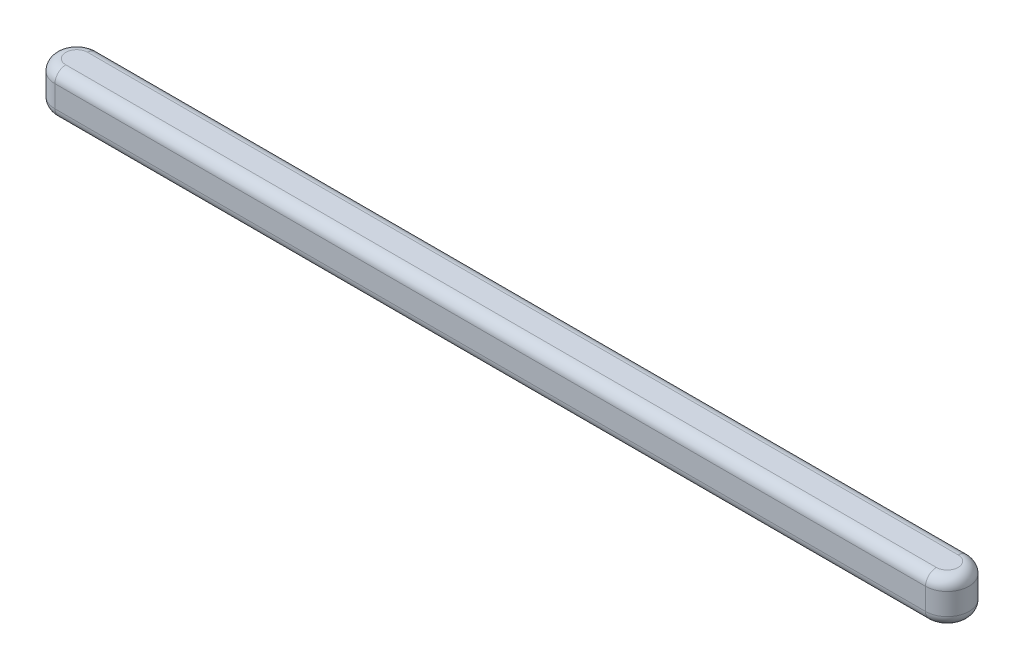
from build123d import *

# Parameters (mm, degrees)
BOSS_EXTRUDE1_DEPTH = 10
FILLET1_R           = 2.5


with BuildPart() as part:
    # Sketch1 → Boss-Extrude1 (new body)
    with BuildSketch(Plane(origin=(0, 0, 0), x_dir=(1, 0, 0), z_dir=(0, 1, 0))):
        with BuildLine():
            Line((0, 5), (200, 5))
            ThreePointArc((200, 5), (205, 0), (200, -5))
            Line((200, -5), (0, -5))
            ThreePointArc((0, -5), (-5, 0), (0, 5))
        make_face()
    extrude(amount=BOSS_EXTRUDE1_DEPTH)

    # Fillet1
    fillet1_edges = [part.edges().sort_by_distance(p)[0] for p in [
        (205, 10, 0),
        (100, 10, -5),
        (-5, 10, 0),
        (100, 0, -5),
        (205, 0, 0),
        (100, 0, 5),
        (-5, 0, 0),
        (100, 10, 5),
    ]]
    fillet(fillet1_edges, radius=FILLET1_R)


solid = part.part
